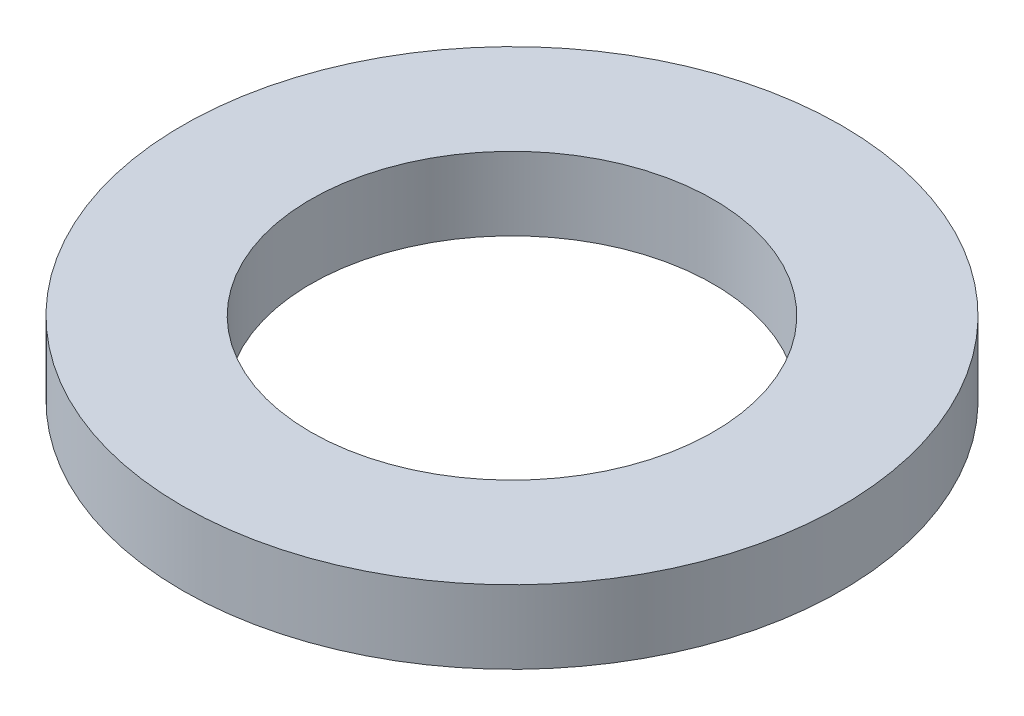
from build123d import *

# Parameters (mm, degrees)
SKETCH_1_R      = 4.5
SKETCH_1_R_2    = 2.75
EXTRUDE_1_DEPTH = 1


with BuildPart() as part:
    # 草图1 → 凸台-拉伸1 (new body)
    with BuildSketch(Plane(origin=(0, 0, 0), x_dir=(1, 0, 0), z_dir=(0, 1, 0))):
        with Locations(Location((0, 0, 0), (0, 0, 270))):
            Circle(SKETCH_1_R)
        with Locations(Location((0, 0, 0), (0, 0, 270))):
            Circle(SKETCH_1_R_2, mode=Mode.SUBTRACT)
    extrude(amount=EXTRUDE_1_DEPTH)


solid = part.part
